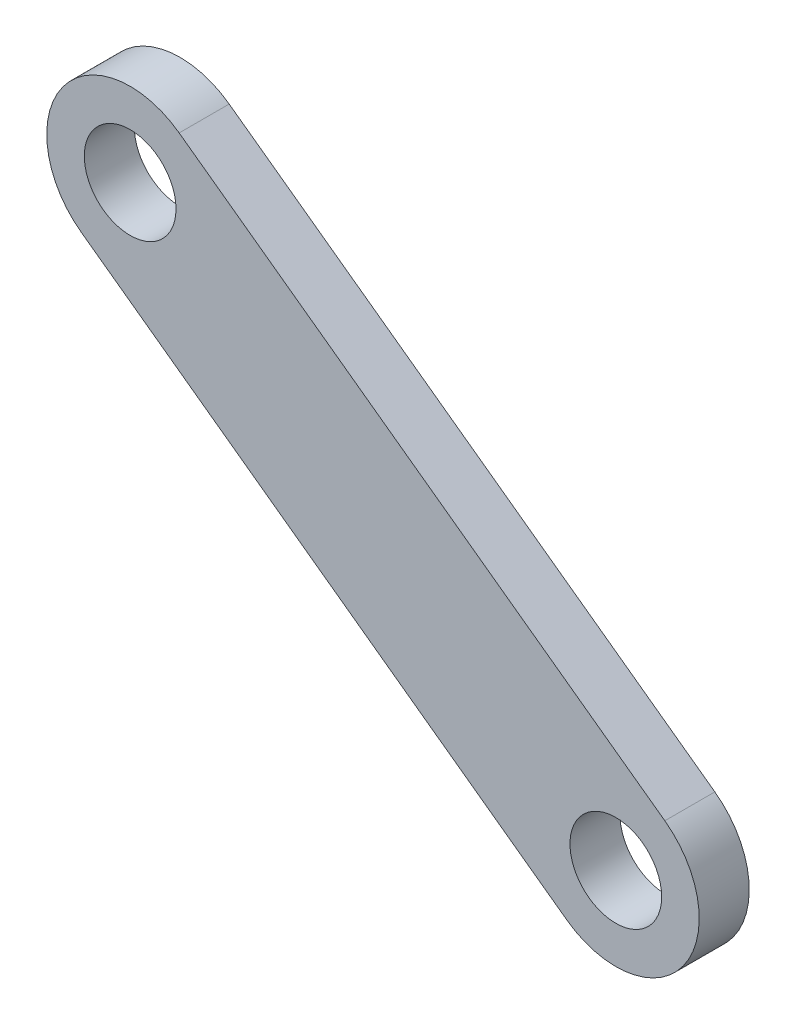
from build123d import *

# Parameters (mm, degrees)
BOSS_EXTRUDE1_DEPTH          = 4.7625
F_5_16_CLEARANCE_HOLE1_D     = 8.72998
F_5_16_CLEARANCE_HOLE2_D     = 8.72998
F_5_16_CLEARANCE_HOLE2_DEPTH = 50.8
F_5_16_CLEARANCE_HOLE2_TIP   = 2.622750593


with BuildPart() as part:
    # Sketch1 → Boss-Extrude1 (new body)
    with BuildSketch(Plane.XY):
        with BuildLine():
            Line((4.66554544, 6.421572393), (50.900866669, -27.170354776))
            ThreePointArc((50.900866669, -27.170354776), (52.656893621, -38.257472609), (41.569775788, -40.013499561))
            Line((41.569775788, -40.013499561), (-4.66554544, -6.421572393))
            ThreePointArc((-4.66554544, -6.421572393), (-6.421572393, 4.66554544), (4.66554544, 6.421572393))
        make_face()
    extrude(amount=BOSS_EXTRUDE1_DEPTH)

    # 5/16 Clearance Hole1 (through all)
    with Locations(Plane.XY.offset(4.7625)):
        with Locations((0, 0), (46.235321229, -33.591927169)):
            Hole(F_5_16_CLEARANCE_HOLE1_D / 2)

    # 5/16 Clearance Hole2
    with Locations(Plane(origin=(-478.115792966, -1361.199382297, 4.7625), x_dir=(0.9364927793764423, 0.3506868605690643, 0), z_dir=(0, 0, 1))):
        with Locations((956.625522808, 1059.411749502)):
            Hole(F_5_16_CLEARANCE_HOLE2_D / 2, depth=F_5_16_CLEARANCE_HOLE2_DEPTH)
            with Locations((0, 0, -(F_5_16_CLEARANCE_HOLE2_DEPTH + F_5_16_CLEARANCE_HOLE2_TIP / 2))):  # 118° drill point
                Cone(0, F_5_16_CLEARANCE_HOLE2_D / 2, F_5_16_CLEARANCE_HOLE2_TIP, mode=Mode.SUBTRACT)


solid = part.part
